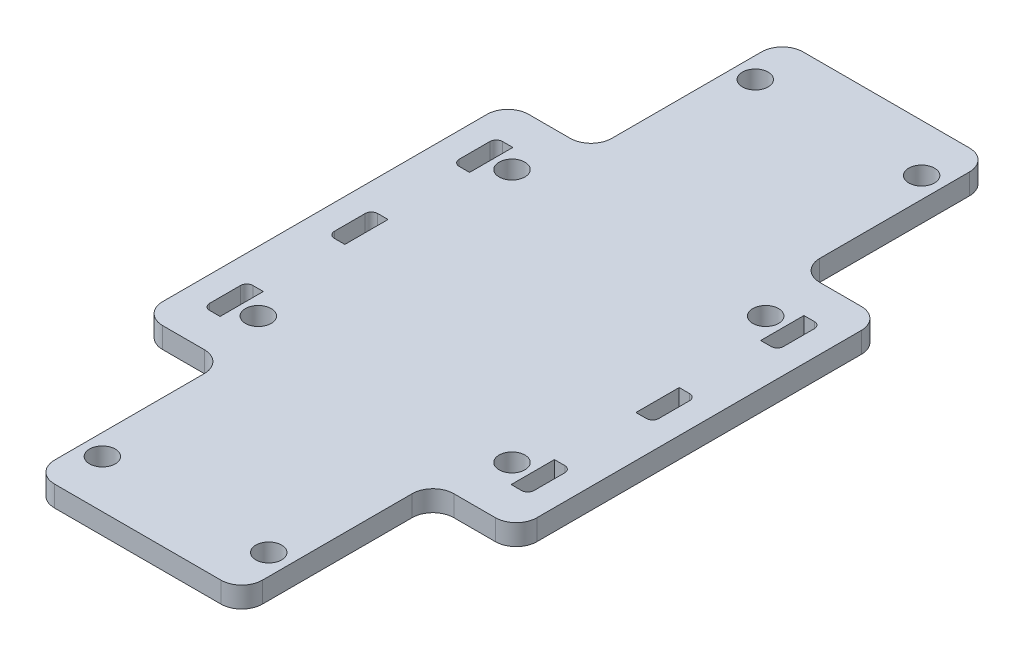
from build123d import *

# Parameters (mm, degrees)
BOSS_EXTRUDE1_DEPTH = 2.5
SKETCH2_R           = 1.55
CUT_EXTRUDE1_DEPTH  = 51.373604199
CUT_EXTRUDE2_DEPTH  = 51.373604199
FILLET2_R           = 2.5
FILLET3_R           = 2.5


with BuildPart() as part:
    # Sketch1 → Boss-Extrude1 (new body)
    with BuildSketch(Plane(origin=(0, 0, 0), x_dir=(1, 0, 0), z_dir=(0, 1, 0))):
        Polygon((12.5, -45), (-12.5, -45), (-12.5, -22), (-22.5, -22), (-22.5, 22), (-12.5, 22), (-12.5, 45), (12.5, 45), (12.5, 22), (22.5, 22), (22.5, -22), (12.5, -22), align=None)
    extrude(amount=BOSS_EXTRUDE1_DEPTH)

    # Sketch2 → Cut-Extrude1 (cut, through all)
    with BuildSketch(Plane(origin=(0, 2.5, 0), x_dir=(1, 0, 0), z_dir=(0, 1, 0))):
        with Locations(Location((-15.25, 15.25, 0), (0, 0, 270))):
            Circle(SKETCH2_R)
        with Locations(Location((15.25, 15.25, 0), (0, 0, 270))):
            Circle(SKETCH2_R)
        with Locations(Location((15.25, -15.25, 0), (0, 0, 90))):
            Circle(SKETCH2_R)
        with Locations(Location((-15.25, -15.25, 0), (0, 0, 90))):
            Circle(SKETCH2_R)
        with Locations(Location((-10, 39.25, 0), (0, 0, 270))):
            Circle(SKETCH2_R)
        with Locations(Location((-10, -39.25, 0), (0, 0, 90))):
            Circle(SKETCH2_R)
        with Locations(Location((10, -39.25, 0), (0, 0, 270))):
            Circle(SKETCH2_R)
        with Locations(Location((10, 39.25, 0), (0, 0, 90))):
            Circle(SKETCH2_R)
    extrude(amount=-CUT_EXTRUDE1_DEPTH, mode=Mode.SUBTRACT)

    # Sketch3 → Cut-Extrude2 (cut, through all)
    with BuildSketch(Plane(origin=(0, 2.5, 0), x_dir=(1, 0, 0), z_dir=(0, 1, 0))):
        with BuildLine():
            Line((-17.5, -2.6), (-18.75, -2.6))
            ThreePointArc((-18.75, -2.6), (-19.280330086, -2.380330086), (-19.5, -1.85))
            Line((-19.5, -1.85), (-19.5, 1.85))
            ThreePointArc((-19.5, 1.85), (-19.280330086, 2.380330086), (-18.75, 2.6))
            Line((-18.75, 2.6), (-17.5, 2.6))
            Line((-17.5, 2.6), (-17.5, -2.6))
        make_face()
        with BuildLine():
            Line((-17.5, 12.4), (-18.75, 12.4))
            ThreePointArc((-18.75, 12.4), (-19.280330086, 12.619669914), (-19.5, 13.15))
            Line((-19.5, 13.15), (-19.5, 16.85))
            ThreePointArc((-19.5, 16.85), (-19.280330086, 17.380330086), (-18.75, 17.6))
            Line((-18.75, 17.6), (-17.5, 17.6))
            Line((-17.5, 17.6), (-17.5, 12.4))
        make_face()
        with BuildLine():
            Line((-17.5, 27.4), (-18.75, 27.4))
            ThreePointArc((-18.75, 27.4), (-19.280330086, 27.619669914), (-19.5, 28.15))
            Line((-19.5, 28.15), (-19.5, 31.85))
            ThreePointArc((-19.5, 31.85), (-19.280330086, 32.380330086), (-18.75, 32.6))
            Line((-18.75, 32.6), (-17.5, 32.6))
            Line((-17.5, 32.6), (-17.5, 27.4))
        make_face()
        with BuildLine():
            Line((19.5, 28.15), (19.5, 31.85))
            ThreePointArc((19.5, 31.85), (19.280330086, 32.380330086), (18.75, 32.6))
            Line((18.75, 32.6), (17.5, 32.6))
            Line((17.5, 32.6), (17.5, 27.4))
            Line((17.5, 27.4), (18.75, 27.4))
            ThreePointArc((18.75, 27.4), (19.280330086, 27.619669914), (19.5, 28.15))
        make_face()
        with BuildLine():
            Line((19.5, 13.15), (19.5, 16.85))
            ThreePointArc((19.5, 16.85), (19.280330086, 17.380330086), (18.75, 17.6))
            Line((18.75, 17.6), (17.5, 17.6))
            Line((17.5, 17.6), (17.5, 12.4))
            Line((17.5, 12.4), (18.75, 12.4))
            ThreePointArc((18.75, 12.4), (19.280330086, 12.619669914), (19.5, 13.15))
        make_face()
        with BuildLine():
            Line((19.5, -1.85), (19.5, 1.85))
            ThreePointArc((19.5, 1.85), (19.280330086, 2.380330086), (18.75, 2.6))
            Line((18.75, 2.6), (17.5, 2.6))
            Line((17.5, 2.6), (17.5, -2.6))
            Line((17.5, -2.6), (18.75, -2.6))
            ThreePointArc((18.75, -2.6), (19.280330086, -2.380330086), (19.5, -1.85))
        make_face()
        with BuildLine():
            Line((17.5, -12.4), (18.75, -12.4))
            ThreePointArc((18.75, -12.4), (19.280330086, -12.619669914), (19.5, -13.15))
            Line((19.5, -13.15), (19.5, -16.85))
            ThreePointArc((19.5, -16.85), (19.280330086, -17.380330086), (18.75, -17.6))
            Line((18.75, -17.6), (17.5, -17.6))
            Line((17.5, -17.6), (17.5, -12.4))
        make_face()
        with BuildLine():
            Line((17.5, -27.4), (18.75, -27.4))
            ThreePointArc((18.75, -27.4), (19.280330086, -27.619669914), (19.5, -28.15))
            Line((19.5, -28.15), (19.5, -31.85))
            ThreePointArc((19.5, -31.85), (19.280330086, -32.380330086), (18.75, -32.6))
            Line((18.75, -32.6), (17.5, -32.6))
            Line((17.5, -32.6), (17.5, -27.4))
        make_face()
        with BuildLine():
            Line((-19.5, -28.15), (-19.5, -31.85))
            ThreePointArc((-19.5, -31.85), (-19.280330086, -32.380330086), (-18.75, -32.6))
            Line((-18.75, -32.6), (-17.5, -32.6))
            Line((-17.5, -32.6), (-17.5, -27.4))
            Line((-17.5, -27.4), (-18.75, -27.4))
            ThreePointArc((-18.75, -27.4), (-19.280330086, -27.619669914), (-19.5, -28.15))
        make_face()
        with BuildLine():
            Line((-19.5, -13.15), (-19.5, -16.85))
            ThreePointArc((-19.5, -16.85), (-19.280330086, -17.380330086), (-18.75, -17.6))
            Line((-18.75, -17.6), (-17.5, -17.6))
            Line((-17.5, -17.6), (-17.5, -12.4))
            Line((-17.5, -12.4), (-18.75, -12.4))
            ThreePointArc((-18.75, -12.4), (-19.280330086, -12.619669914), (-19.5, -13.15))
        make_face()
    extrude(amount=-CUT_EXTRUDE2_DEPTH, mode=Mode.SUBTRACT)

    # Fillet2
    fillet2_edges = [part.edges().sort_by_distance(p)[0] for p in [
        (-12.5, 1.25, 22),
        (-22.5, 1.25, 22),
        (-22.5, 1.25, -22),
        (-12.5, 1.25, -22),
        (12.5, 1.25, -22),
        (22.5, 1.25, -22),
        (22.5, 1.25, 22),
        (12.5, 1.25, 22),
    ]]
    fillet(fillet2_edges, radius=FILLET2_R)

    # Fillet3
    fillet3_edges = [part.edges().sort_by_distance(p)[0] for p in [
        (12.5, 1.25, 45),
        (-12.5, 1.25, 45),
        (-12.5, 1.25, -45),
        (12.5, 1.25, -45),
    ]]
    fillet(fillet3_edges, radius=FILLET3_R)


solid = part.part
